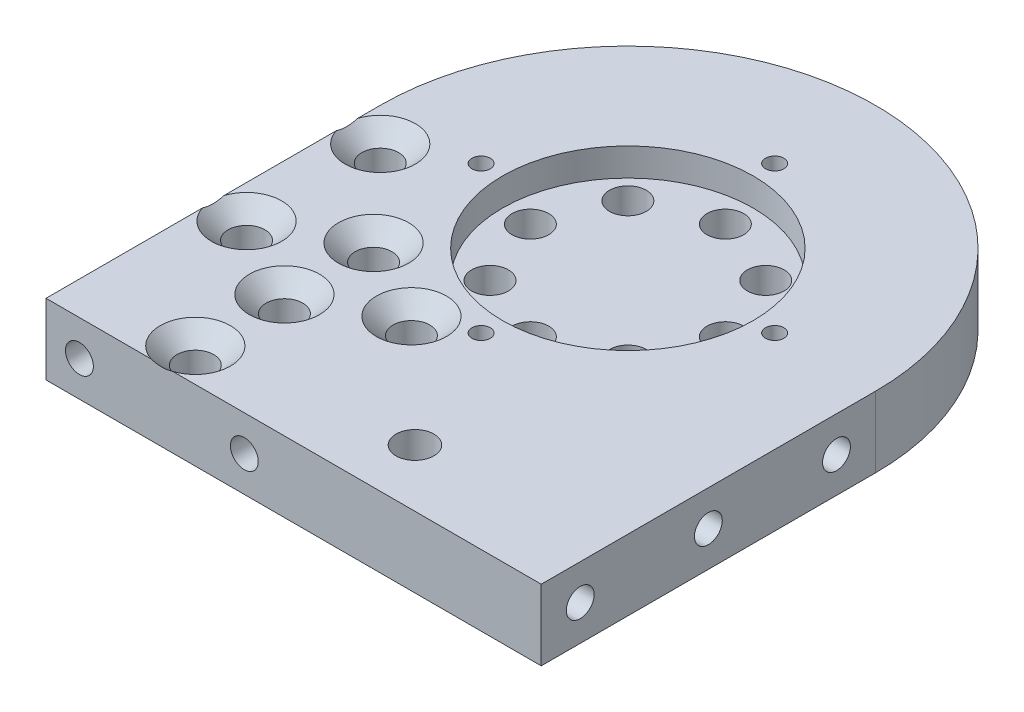
from build123d import *

# Parameters (mm, degrees)
EXTRUDE_1_DEPTH               = 12.7
SKETCH_2_R                    = 22.5
CUT_EXTRUDE_1_DEPTH           = 5
SKETCH_3_R                    = 1.65
CUT_EXTRUDE_2_DEPTH           = 76.743597089
SKETCH_4_R                    = 3.3
CUT_EXTRUDE_3_DEPTH           = 76.06725318
CUT_EXTRUDE_4_DEPTH           = 76.743597089
CUT_EXTRUDE_4_DEPTH_BACK      = 76.743597089
SKETCH_5_R                    = 3.3
SKETCH_6_R                    = 6.3
CUT_EXTRUDE_5_DEPTH           = 3
CUT_EXTRUDE_5_DRAFT           = -45
CUT_EXTRUDE_5_PROFILE_2_DEPTH = 3
CUT_EXTRUDE_5_PROFILE_2_DRAFT = -45
CUT_EXTRUDE_5_PROFILE_3_DEPTH = 3
CUT_EXTRUDE_5_PROFILE_3_DRAFT = -45
CUT_EXTRUDE_5_PROFILE_4_DEPTH = 3
CUT_EXTRUDE_5_PROFILE_4_DRAFT = -45
CUT_EXTRUDE_5_PROFILE_5_DEPTH = 3
CUT_EXTRUDE_5_PROFILE_5_DRAFT = -45
SKETCH_7_R                    = 3.3
CUT_EXTRUDE_6_DEPTH           = 76.743597089
SKETCH_8_R                    = 6.3
CUT_EXTRUDE_7_DEPTH           = 3
CUT_EXTRUDE_7_DRAFT           = -45
SKETCH_9_R                    = 2.5
CUT_EXTRUDE_8_DEPTH           = 15
SKETCH_10_R                   = 3.4
CUT_EXTRUDE_9_DEPTH           = 76.743597089
SKETCH_11_R                   = 2.5
CUT_EXTRUDE_10_DEPTH          = 10


with BuildPart() as part:
    # 草图1 → 凸台-拉伸1 (new body)
    with BuildSketch(Plane(origin=(0, 0, 0), x_dir=(1, 0, 0), z_dir=(0, 1, 0))):
        with BuildLine():
            Line((-44.45, 0), (-44.45, -60))
            Line((-44.45, -60), (44.45, -60))
            Line((44.45, -60), (44.45, 0))
            ThreePointArc((44.45, 0), (0, 44.45), (-44.45, 0))
        make_face()
    extrude(amount=EXTRUDE_1_DEPTH)

    # 草图2 → 切除-拉伸1 (cut)
    with BuildSketch(Plane(origin=(0, 12.7, 0), x_dir=(1, 0, 0), z_dir=(0, 1, 0))):
        with Locations(Location((0, 0, 0), (0, 0, 270))):
            Circle(SKETCH_2_R)
    extrude(amount=-CUT_EXTRUDE_1_DEPTH, mode=Mode.SUBTRACT)

    # 草图3 → 切除-拉伸2 (cut, through all)
    with BuildSketch(Plane(origin=(0, 12.7, 0), x_dir=(1, 0, 0), z_dir=(0, 1, 0))):
        with Locations(Location((0, 26.35, 0), (0, 0, 270))):
            Circle(SKETCH_3_R)
        with Locations(Location((26.35, 0, 0), (0, 0, 270))):
            Circle(SKETCH_3_R)
        with Locations(Location((0, -26.35, 0), (0, 0, 270))):
            Circle(SKETCH_3_R)
        with Locations(Location((-26.35, 0, 0), (0, 0, 270))):
            Circle(SKETCH_3_R)
    extrude(amount=-CUT_EXTRUDE_2_DEPTH, mode=Mode.SUBTRACT)

    # 草图4 → 切除-拉伸3 (cut, through all)
    with BuildSketch(Plane(origin=(0, 7.7, 0), x_dir=(1, 0, 0), z_dir=(0, 1, 0))):
        with Locations(Location((0, 17.5, 0), (0, 0, 270))):
            Circle(SKETCH_4_R)
        with Locations(Location((12.374368671, 12.374368671, 0), (0, 0, 270))):
            Circle(SKETCH_4_R)
        with Locations(Location((17.5, 0, 0), (0, 0, 270))):
            Circle(SKETCH_4_R)
        with Locations(Location((12.374368671, -12.374368671, 0), (0, 0, 270))):
            Circle(SKETCH_4_R)
        with Locations(Location((0, -17.5, 0), (0, 0, 270))):
            Circle(SKETCH_4_R)
        with Locations(Location((-12.374368671, -12.374368671, 0), (0, 0, 270))):
            Circle(SKETCH_4_R)
        with Locations(Location((-17.5, 0, 0), (0, 0, 270))):
            Circle(SKETCH_4_R)
        with Locations(Location((-12.374368671, 12.374368671, 0), (0, 0, 270))):
            Circle(SKETCH_4_R)
    extrude(amount=-CUT_EXTRUDE_3_DEPTH, mode=Mode.SUBTRACT)

    # 草图5 → 切除-拉伸4 (cut, two sides: drawn at the far end of the back side and taken through both)
    with BuildSketch(Plane(origin=(0, 12.7, 0), x_dir=(1, 0, 0), z_dir=(0, 1, 0)).offset(-CUT_EXTRUDE_4_DEPTH_BACK)):
        with Locations(Location((-23.65, -54, 0), (0, 0, 270))):
            Circle(SKETCH_5_R)
        with Locations(Location((-23.65, -38, 0), (0, 0, 270))):
            Circle(SKETCH_5_R)
        with Locations(Location((-8.85, -30, 0), (0, 0, 270))):
            Circle(SKETCH_5_R)
        with Locations(Location((-38.45, -30, 0), (0, 0, 270))):
            Circle(SKETCH_5_R)
        with Locations(Location((-23.65, -22, 0), (0, 0, 270))):
            Circle(SKETCH_5_R)
    extrude(amount=CUT_EXTRUDE_4_DEPTH + CUT_EXTRUDE_4_DEPTH_BACK, mode=Mode.SUBTRACT)


with BuildPart() as cut_extrude_5_tool:
    # 草图6 → 切除-拉伸5 (with draft: the straight prism first)
    with BuildSketch(Plane(origin=(0, 12.7, 0), x_dir=(1, 0, 0), z_dir=(0, 1, 0))):
        with Locations((-23.65, -22)):
            Circle(SKETCH_6_R)
    extrude(amount=-CUT_EXTRUDE_5_DEPTH)
    # 切除-拉伸5: the draft: its side faces are tilted about the plane it starts from
    cut_extrude_5_sides = [cut_extrude_5_tool.faces().sort_by_distance(p)[0] for p in [
        (-29.95, 11.2, 22),
    ]]
    draft(cut_extrude_5_sides, Plane(origin=(0, 12.7, 0), x_dir=(1, 0, 0), z_dir=(0, 1, 0)), CUT_EXTRUDE_5_DRAFT)


with BuildPart() as part_1:
    add(part.part)

    # 切除-拉伸5: cut by cut_extrude_5_tool
    add(cut_extrude_5_tool.part, mode=Mode.SUBTRACT)


with BuildPart() as cut_extrude_5_profile_2_tool:
    # 草图6 → 切除-拉伸5 profile 2 (with draft: the straight prism first)
    with BuildSketch(Plane(origin=(0, 12.7, 0), x_dir=(1, 0, 0), z_dir=(0, 1, 0))):
        with Locations((-8.85, -30)):
            Circle(SKETCH_6_R)
    extrude(amount=-CUT_EXTRUDE_5_PROFILE_2_DEPTH)
    # 切除-拉伸5 profile 2: the draft: its side faces are tilted about the plane it starts from
    cut_extrude_5_profile_2_sides = [cut_extrude_5_profile_2_tool.faces().sort_by_distance(p)[0] for p in [
        (-15.15, 11.2, 30),
    ]]
    draft(cut_extrude_5_profile_2_sides, Plane(origin=(0, 12.7, 0), x_dir=(1, 0, 0), z_dir=(0, 1, 0)), CUT_EXTRUDE_5_PROFILE_2_DRAFT)


with BuildPart() as part_2:
    add(part_1.part)

    # 切除-拉伸5 profile 2: cut by cut_extrude_5_profile_2_tool
    add(cut_extrude_5_profile_2_tool.part, mode=Mode.SUBTRACT)


with BuildPart() as cut_extrude_5_profile_3_tool:
    # 草图6 → 切除-拉伸5 profile 3 (with draft: the straight prism first)
    with BuildSketch(Plane(origin=(0, 12.7, 0), x_dir=(1, 0, 0), z_dir=(0, 1, 0))):
        with Locations((-23.65, -38)):
            Circle(SKETCH_6_R)
    extrude(amount=-CUT_EXTRUDE_5_PROFILE_3_DEPTH)
    # 切除-拉伸5 profile 3: the draft: its side faces are tilted about the plane it starts from
    cut_extrude_5_profile_3_sides = [cut_extrude_5_profile_3_tool.faces().sort_by_distance(p)[0] for p in [
        (-29.95, 11.2, 38),
    ]]
    draft(cut_extrude_5_profile_3_sides, Plane(origin=(0, 12.7, 0), x_dir=(1, 0, 0), z_dir=(0, 1, 0)), CUT_EXTRUDE_5_PROFILE_3_DRAFT)


with BuildPart() as part_3:
    add(part_2.part)

    # 切除-拉伸5 profile 3: cut by cut_extrude_5_profile_3_tool
    add(cut_extrude_5_profile_3_tool.part, mode=Mode.SUBTRACT)


with BuildPart() as cut_extrude_5_profile_4_tool:
    # 草图6 → 切除-拉伸5 profile 4 (with draft: the straight prism first)
    with BuildSketch(Plane(origin=(0, 12.7, 0), x_dir=(1, 0, 0), z_dir=(0, 1, 0))):
        with Locations((-38.45, -30)):
            Circle(SKETCH_6_R)
    extrude(amount=-CUT_EXTRUDE_5_PROFILE_4_DEPTH)
    # 切除-拉伸5 profile 4: the draft: its side faces are tilted about the plane it starts from
    cut_extrude_5_profile_4_sides = [cut_extrude_5_profile_4_tool.faces().sort_by_distance(p)[0] for p in [
        (-44.75, 11.2, 30),
    ]]
    draft(cut_extrude_5_profile_4_sides, Plane(origin=(0, 12.7, 0), x_dir=(1, 0, 0), z_dir=(0, 1, 0)), CUT_EXTRUDE_5_PROFILE_4_DRAFT)


with BuildPart() as part_4:
    add(part_3.part)

    # 切除-拉伸5 profile 4: cut by cut_extrude_5_profile_4_tool
    add(cut_extrude_5_profile_4_tool.part, mode=Mode.SUBTRACT)


with BuildPart() as cut_extrude_5_profile_5_tool:
    # 草图6 → 切除-拉伸5 profile 5 (with draft: the straight prism first)
    with BuildSketch(Plane(origin=(0, 12.7, 0), x_dir=(1, 0, 0), z_dir=(0, 1, 0))):
        with Locations((-23.65, -54)):
            Circle(SKETCH_6_R)
    extrude(amount=-CUT_EXTRUDE_5_PROFILE_5_DEPTH)
    # 切除-拉伸5 profile 5: the draft: its side faces are tilted about the plane it starts from
    cut_extrude_5_profile_5_sides = [cut_extrude_5_profile_5_tool.faces().sort_by_distance(p)[0] for p in [
        (-29.95, 11.2, 54),
    ]]
    draft(cut_extrude_5_profile_5_sides, Plane(origin=(0, 12.7, 0), x_dir=(1, 0, 0), z_dir=(0, 1, 0)), CUT_EXTRUDE_5_PROFILE_5_DRAFT)


with BuildPart() as part_5:
    add(part_4.part)

    # 切除-拉伸5 profile 5: cut by cut_extrude_5_profile_5_tool
    add(cut_extrude_5_profile_5_tool.part, mode=Mode.SUBTRACT)

    # 草图7 → 切除-拉伸6 (cut, through all)
    with BuildSketch(Plane(origin=(0, 12.7, 0), x_dir=(1, 0, 0), z_dir=(0, 1, 0))):
        with Locations(Location((-38.45, -6, 0), (0, 0, 270))):
            Circle(SKETCH_7_R)
    extrude(amount=-CUT_EXTRUDE_6_DEPTH, mode=Mode.SUBTRACT)


with BuildPart() as cut_extrude_7_tool:
    # 草图8 → 切除-拉伸7 (with draft: the straight prism first)
    with BuildSketch(Plane(origin=(0, 12.7, 0), x_dir=(1, 0, 0), z_dir=(0, 1, 0))):
        with Locations((-38.45, -6)):
            Circle(SKETCH_8_R)
    extrude(amount=-CUT_EXTRUDE_7_DEPTH)
    # 切除-拉伸7: the draft: its side faces are tilted about the plane it starts from
    cut_extrude_7_sides = [cut_extrude_7_tool.faces().sort_by_distance(p)[0] for p in [
        (-44.75, 11.2, 6),
    ]]
    draft(cut_extrude_7_sides, Plane(origin=(0, 12.7, 0), x_dir=(1, 0, 0), z_dir=(0, 1, 0)), CUT_EXTRUDE_7_DRAFT)


with BuildPart() as part_6:
    add(part_5.part)

    # 切除-拉伸7: cut by cut_extrude_7_tool
    add(cut_extrude_7_tool.part, mode=Mode.SUBTRACT)

    # 草图9 → 切除-拉伸8 (cut)
    with BuildSketch(Plane.XY.offset(60)):
        with Locations((-38.45, 6.35)):
            Circle(SKETCH_9_R)
        with Locations((-8.85, 6.35)):
            Circle(SKETCH_9_R)
    extrude(amount=-CUT_EXTRUDE_8_DEPTH, mode=Mode.SUBTRACT)

    # 草图10 → 切除-拉伸9 (cut, through all)
    with BuildSketch(Plane(origin=(0, 12.7, 0), x_dir=(1, 0, 0), z_dir=(0, 1, 0))):
        with Locations(Location((11.47, -49.69, 0), (0, 0, 270))):
            Circle(SKETCH_10_R)
    extrude(amount=-CUT_EXTRUDE_9_DEPTH, mode=Mode.SUBTRACT)

    # 草图11 → 切除-拉伸10 (cut)
    with BuildSketch(Plane(origin=(44.45, 0, 0), x_dir=(0, 0, -1), z_dir=(1, 0, 0))):
        with Locations((-53, 6.35)):
            Circle(SKETCH_11_R)
        with Locations((-30, 6.35)):
            Circle(SKETCH_11_R)
        with Locations((-7, 6.35)):
            Circle(SKETCH_11_R)
    extrude(amount=-CUT_EXTRUDE_10_DEPTH, mode=Mode.SUBTRACT)


solid = part_6.part
